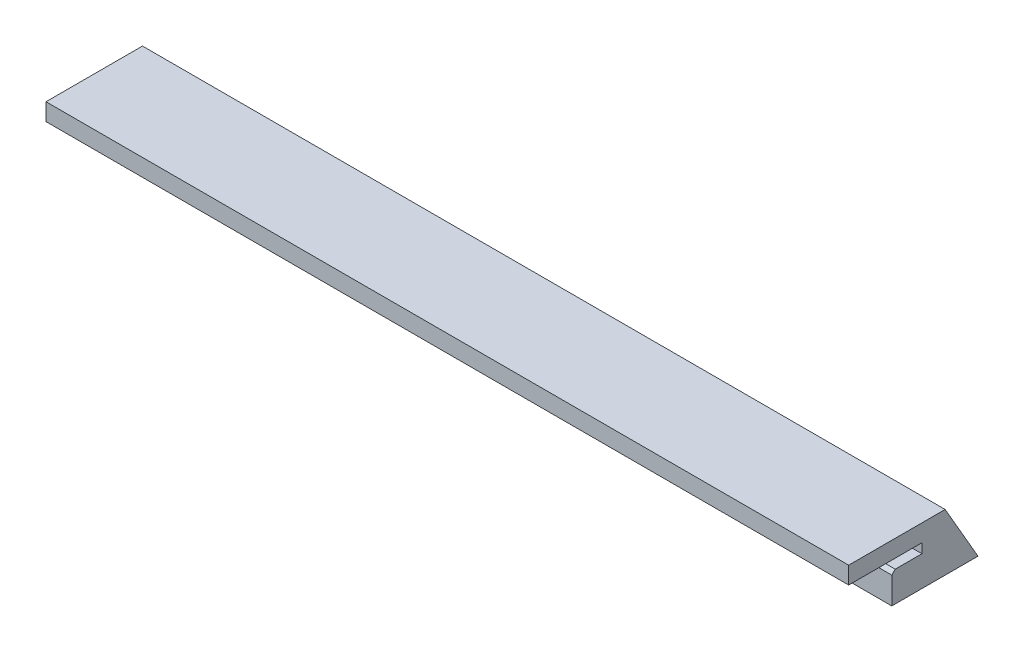
from build123d import *

# Parameters (mm, degrees)
SKETCH_2_W                  = 93.1
SKETCH_2_H                  = 10
EXTRUDE_1_DEPTH             = 3.5
SKETCH_4_W                  = 93.1
SKETCH_4_H                  = 6.5
EXTRUDE_2_DEPTH             = 1.1
SKETCH_5_W                  = 93.1
SKETCH_5_H                  = 10
EXTRUDE_3_DEPTH             = 2
CUT_EXTRUDE_1_DEPTH         = 94.867832616
SKETCH_7_W                  = 83.1
SKETCH_7_H                  = 1.1
EXTRUDE_4_DEPTH             = 3.5
CHAMFER_1_SIZE              = 0.4
CUT_EXTRUDE_2_REACH         = 95.868
SKETCH_8_R                  = 150
SKETCH_9_W                  = 93.1
SKETCH_9_H                  = 2
EXTRUDE_5_DEPTH             = 5
EXTRUDE_5_DIRECTION_2_REACH = 95.868


with BuildPart() as part:
    # 草图2 → 凸台-拉伸1 (new body)
    with BuildSketch(Plane(origin=(0, 0, 0), x_dir=(1, 0, 0), z_dir=(0, 1, 0))):
        with Locations((46.55, 5)):
            Rectangle(SKETCH_2_W, SKETCH_2_H)
    extrude(amount=EXTRUDE_1_DEPTH)

    # 草图4 → 凸台-拉伸2 (add)
    with BuildSketch(Plane(origin=(0, 3.5, 0), x_dir=(1, 0, 0), z_dir=(0, 1, 0))):
        with Locations((46.55, 6.75)):
            Rectangle(SKETCH_4_W, SKETCH_4_H)
    extrude(amount=EXTRUDE_2_DEPTH)

    # 草图5 → 凸台-拉伸3 (add)
    with BuildSketch(Plane(origin=(0, 4.6, 0), x_dir=(1, 0, 0), z_dir=(0, 1, 0))):
        with Locations((46.55, 5)):
            Rectangle(SKETCH_5_W, SKETCH_5_H)
    extrude(amount=EXTRUDE_3_DEPTH)

    # 草图6 → 切除-拉伸1 (cut, through all)
    with BuildSketch(Plane.ZY):
        Polygon((-10, 0), (-6.189488223, 6.6), (-10, 6.6), align=None)
    extrude(amount=-CUT_EXTRUDE_1_DEPTH, mode=Mode.SUBTRACT)

    # 草图7 → 凸台-拉伸4 (add)
    with BuildSketch(Plane.XY.offset(-3.5)):
        with Locations((46.55, 4.05)):
            Rectangle(SKETCH_7_W, SKETCH_7_H)
    extrude(amount=EXTRUDE_4_DEPTH)

    # 倒角1
    chamfer_1_edges = [part.edges().sort_by_distance(p)[0] for p in [
        (90.6, 3.5, 0),
        (2.5, 3.5, 0),
    ]]
    chamfer(chamfer_1_edges, length=CHAMFER_1_SIZE)

    # 草图8 → 切除-拉伸2 (cut, up to next)
    with BuildSketch(Plane.XZ, mode=Mode.PRIVATE) as cut_extrude_2_sk1:
        with Locations((46.55, 147)):
            Circle(SKETCH_8_R)
    cut_extrude_2_tool1 = extrude(cut_extrude_2_sk1.sketch, amount=-CUT_EXTRUDE_2_REACH, mode=Mode.PRIVATE) & part.part
    add(cut_extrude_2_tool1.solids().sort_by_distance((46.55, 0, 147))[0], mode=Mode.SUBTRACT)

    # 草图9 → 凸台-拉伸5 (add)
    with BuildSketch(Plane.XY):
        with Locations((46.55, 5.6)):
            Rectangle(SKETCH_9_W, SKETCH_9_H)
    extrude(amount=EXTRUDE_5_DEPTH)

    # 草图9 → 凸台-拉伸5 direction 2 (add, up to next)
    with BuildSketch(Plane.XY, mode=Mode.PRIVATE) as extrude_5_direction_2_sk1:
        with Locations((46.55, 5.6)):
            Rectangle(SKETCH_9_W, SKETCH_9_H)
    extrude_5_direction_2_tool1 = extrude(extrude_5_direction_2_sk1.sketch, amount=-EXTRUDE_5_DIRECTION_2_REACH, mode=Mode.PRIVATE) - part.part
    add(extrude_5_direction_2_tool1.solids().sort_by_distance((46.55, 5.6, 0))[0])


solid = part.part
